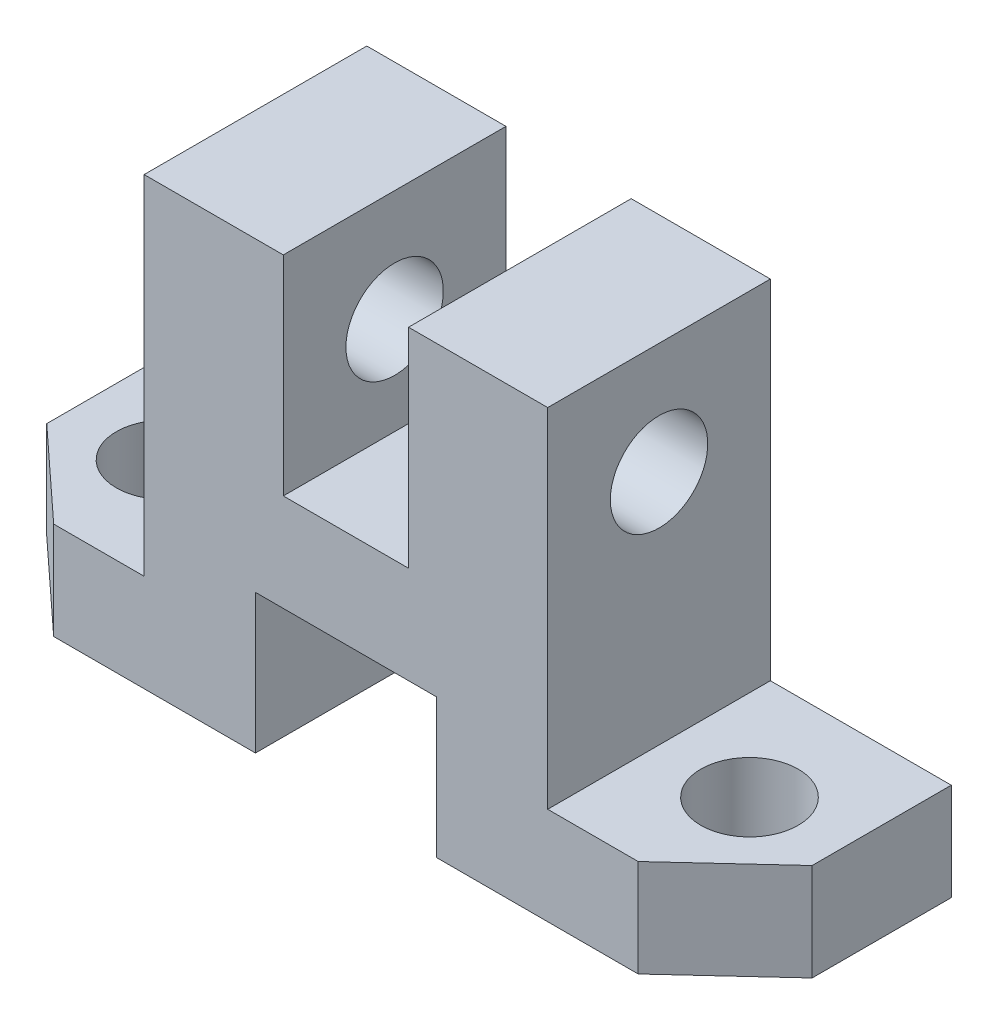
from build123d import *

# Parameters (mm, degrees)
BOSS_EXTRUDE1_DEPTH     = 16
SKETCH8_R               = 3.5
CUT_EXTRUDE1_DEPTH      = 16
SKETCH11_R              = 3.5
CUT_EXTRUDE2_DEPTH      = 16
CUT_EXTRUDE3_DEPTH      = 56.172456897
CUT_EXTRUDE3_DEPTH_BACK = 56.172456897
SKETCH12_R              = 3.5
CUT_EXTRUDE4_DEPTH      = 63.497999968
CUT_EXTRUDE4_DEPTH_BACK = 63.497999968
CUT_EXTRUDE5_DEPTH      = 63.497999968
CUT_EXTRUDE5_DEPTH_BACK = 63.497999968


with BuildPart() as part:
    # Sketch3 → Boss-Extrude1 (new body)
    with BuildSketch(Plane.XY):
        Polygon((0, 0), (21, 0), (21, 10), (34, 10), (34, 0), (55, 0), (55, 7), (42, 7), (42, 32), (32, 32), (32, 17), (23, 17), (23, 32), (13, 32), (13, 7), (0, 7), align=None)
    extrude(amount=BOSS_EXTRUDE1_DEPTH)

    # Sketch8 → Cut-Extrude1 (cut)
    with BuildSketch(Plane(origin=(0, 7, 0), x_dir=(1, 0, 0), z_dir=(0, 1, 0))):
        with Locations(Location((6.5, -8, 0), (0, 0, 270))):
            Circle(SKETCH8_R)
    extrude(amount=-CUT_EXTRUDE1_DEPTH, mode=Mode.SUBTRACT)

    # Sketch11 → Cut-Extrude2 (cut)
    with BuildSketch(Plane(origin=(0, 7, 0), x_dir=(1, 0, 0), z_dir=(0, 1, 0))):
        with Locations(Location((48.5, -8, 0), (0, 0, 270))):
            Circle(SKETCH11_R)
    extrude(amount=-CUT_EXTRUDE2_DEPTH, mode=Mode.SUBTRACT)

    # Sketch12 → Cut-Extrude3 (cut, two sides: drawn at the far end of the back side and taken through both)
    with BuildSketch(Plane.ZY.offset(-13).offset(-CUT_EXTRUDE3_DEPTH_BACK)):
        with Locations((8, 24)):
            Circle(SKETCH12_R)
    extrude(amount=CUT_EXTRUDE3_DEPTH + CUT_EXTRUDE3_DEPTH_BACK, mode=Mode.SUBTRACT)

    # Sketch13 → Cut-Extrude4 (cut, two sides: drawn at the far end of the back side and taken through both)
    with BuildSketch(Plane(origin=(0, 7, 0), x_dir=(1, 0, 0), z_dir=(0, 1, 0)).offset(-CUT_EXTRUDE4_DEPTH_BACK)):
        Polygon((6.5, -16), (0, -16), (0, -10), align=None)
    extrude(amount=CUT_EXTRUDE4_DEPTH + CUT_EXTRUDE4_DEPTH_BACK, mode=Mode.SUBTRACT)

    # Sketch14 → Cut-Extrude5 (cut, two sides: drawn at the far end of the back side and taken through both)
    with BuildSketch(Plane(origin=(0, 7, 0), x_dir=(1, 0, 0), z_dir=(0, 1, 0)).offset(-CUT_EXTRUDE5_DEPTH_BACK)):
        Polygon((55, -16), (55, -10), (48.5, -16), align=None)
    extrude(amount=CUT_EXTRUDE5_DEPTH + CUT_EXTRUDE5_DEPTH_BACK, mode=Mode.SUBTRACT)


solid = part.part
